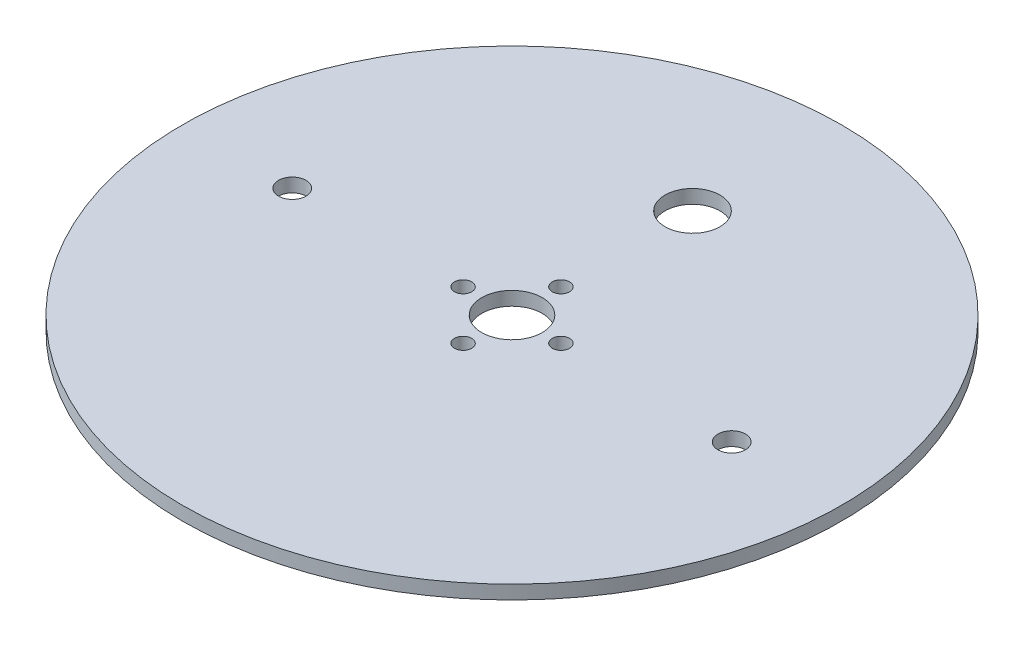
from build123d import *

# Parameters (mm, degrees)
SKETCH1_R           = 76.2
BOSS_EXTRUDE1_DEPTH = 3.175
SKETCH2_R           = 7
CUT_EXTRUDE1_DEPTH  = 108.809835474
SKETCH3_R           = 2
CUT_EXTRUDE2_DEPTH  = 108.809835474
SKETCH4_R           = 3.175
CUT_EXTRUDE3_DEPTH  = 108.809835474
CUT_EXTRUDE4_REACH  = 109.81
SKETCH5_R           = 6.35


with BuildPart() as part:
    # Sketch1 → Boss-Extrude1 (new body)
    with BuildSketch(Plane(origin=(0, 0, 0), x_dir=(1, 0, 0), z_dir=(0, 1, 0))):
        with Locations(Location((0, 0, 0), (0, 0, 270))):
            Circle(SKETCH1_R)
    extrude(amount=BOSS_EXTRUDE1_DEPTH)

    # Sketch2 → Cut-Extrude1 (cut, through all)
    with BuildSketch(Plane(origin=(0, 3.175, 0), x_dir=(1, 0, 0), z_dir=(0, 1, 0))):
        with Locations(Location((0, 0, 0), (0, 0, 270))):
            Circle(SKETCH2_R)
    extrude(amount=-CUT_EXTRUDE1_DEPTH, mode=Mode.SUBTRACT)

    # Sketch3 → Cut-Extrude2 (cut, through all)
    with BuildSketch(Plane(origin=(0, 3.175, 0), x_dir=(1, 0, 0), z_dir=(0, 1, 0))):
        with Locations(Location((11.314, 0, 0), (0, 0, 270))):
            Circle(SKETCH3_R)
        with Locations(Location((0, -11.314, 0), (0, 0, 270))):
            Circle(SKETCH3_R)
        with Locations(Location((-11.314, 0, 0), (0, 0, 270))):
            Circle(SKETCH3_R)
        with Locations(Location((0, 11.314, 0), (0, 0, 270))):
            Circle(SKETCH3_R)
    extrude(amount=-CUT_EXTRUDE2_DEPTH, mode=Mode.SUBTRACT)

    # Sketch4 → Cut-Extrude3 (cut, through all)
    with BuildSketch(Plane.XZ):
        with Locations(Location((-50.8, 0, 0), (0, 0, 270))):
            Circle(SKETCH4_R)
        with Locations(Location((50.8, 0, 0), (0, 0, 270))):
            Circle(SKETCH4_R)
    extrude(amount=-CUT_EXTRUDE3_DEPTH, mode=Mode.SUBTRACT)

    # Sketch5 → Cut-Extrude4 (cut, up to next)
    with BuildSketch(Plane(origin=(0, 3.175, 0), x_dir=(1, 0, 0), z_dir=(0, 1, 0)), mode=Mode.PRIVATE) as cut_extrude4_sk1:
        with Locations(Location((0, 41.73382544, 0), (0, 0, 270))):
            Circle(SKETCH5_R)
    cut_extrude4_tool1 = extrude(cut_extrude4_sk1.sketch, amount=-CUT_EXTRUDE4_REACH, mode=Mode.PRIVATE) & part.part
    add(cut_extrude4_tool1.solids().sort_by_distance((0, 3.175, -41.733825))[0], mode=Mode.SUBTRACT)


solid = part.part
